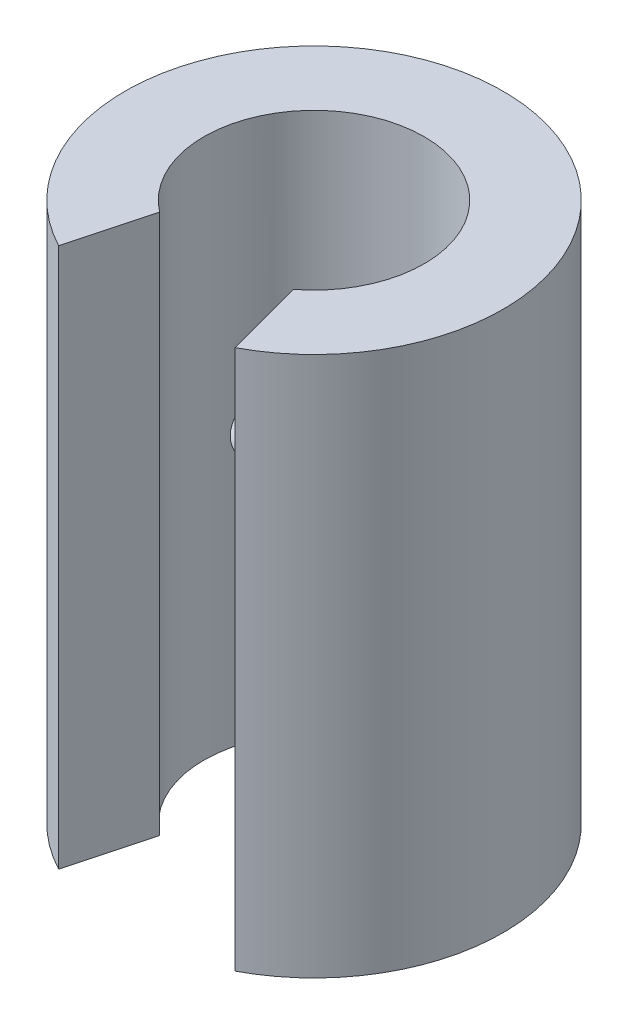
from build123d import *

# Parameters (mm, degrees)
SKETCH1_R           = 11.1125
BOSS_EXTRUDE1_DEPTH = 31.75
CUT_EXTRUDE1_DEPTH  = 36.426512847
SKETCH3_R           = 1.778
CUT_EXTRUDE2_DEPTH  = 31.75


with BuildPart() as part:
    # Sketch1 → Boss-Extrude1 (new body)
    with BuildSketch(Plane(origin=(0, 0, 0), x_dir=(1, 0, 0), z_dir=(0, 1, 0))):
        with Locations(Location((0, 0, 0), (0, 0, 270))):
            Circle(SKETCH1_R)
    extrude(amount=BOSS_EXTRUDE1_DEPTH)

    # Sketch2 → Cut-Extrude1 (cut, through all)
    with BuildSketch(Plane(origin=(0, 31.75, 0), x_dir=(1, 0, 0), z_dir=(0, 1, 0))):
        with BuildLine():
            Line((-3.937, -5.14310801), (-5.191572052, -9.825234648))
            ThreePointArc((-5.191572052, -9.825234648), (0, -11.1125), (5.191572052, -9.825234648))
            Line((5.191572052, -9.825234648), (3.937, -5.14310801))
            ThreePointArc((3.937, -5.14310801), (0, 6.477), (-3.937, -5.14310801))
        make_face()
    extrude(amount=-CUT_EXTRUDE1_DEPTH, mode=Mode.SUBTRACT)

    # Sketch3 → Cut-Extrude2 (cut)
    with BuildSketch(Plane(origin=(0, 0, 0), x_dir=(0, 0, -1), z_dir=(1, 0, 0))):
        with Locations((3.175, 15.875)):
            Circle(SKETCH3_R)
    extrude(amount=-CUT_EXTRUDE2_DEPTH, mode=Mode.SUBTRACT)


solid = part.part
